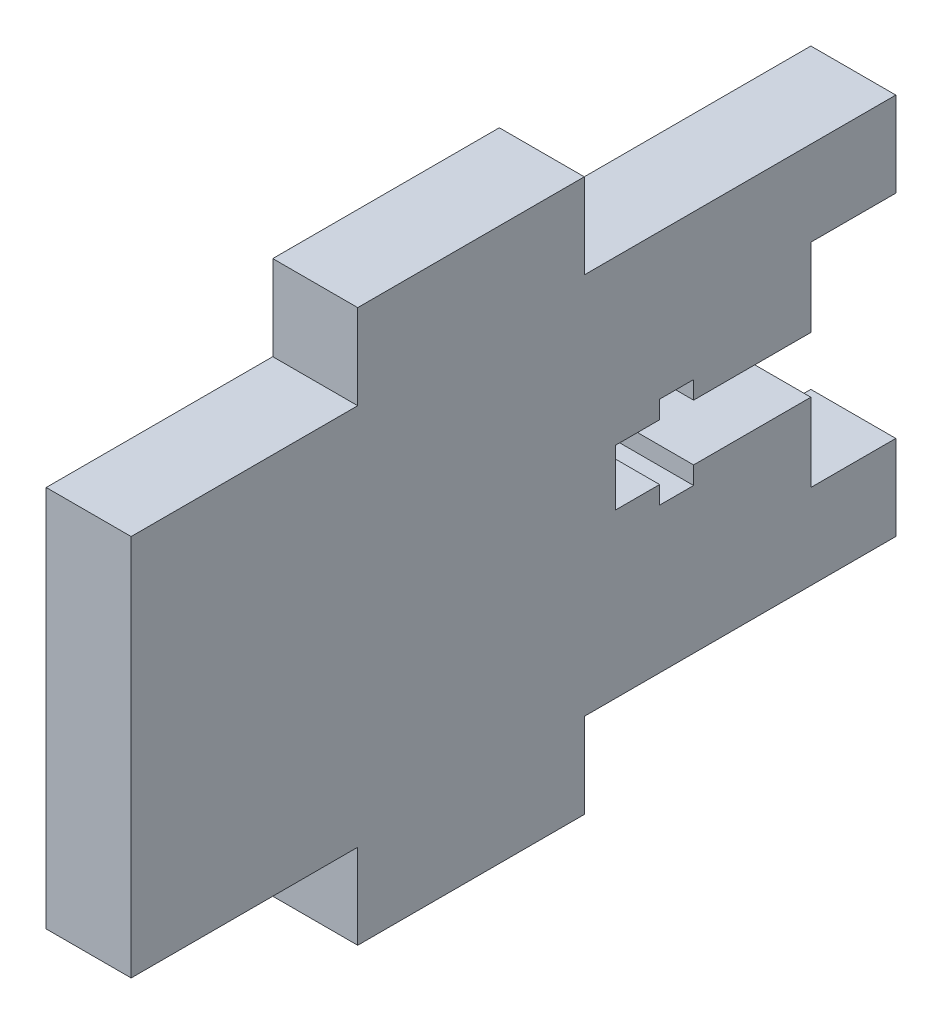
from build123d import *

# Parameters (mm, degrees)
SKETCH1_W           = 6.35
SKETCH1_H           = 28.575
BOSS_EXTRUDE1_DEPTH = 50.8
BOSS_EXTRUDE2_START = -34.925
SKETCH2_W           = 6.35
SKETCH2_H           = 16.933333334
BOSS_EXTRUDE2_DEPTH = 41.275
SKETCH3_W           = 6.35
SKETCH3_H           = 6.35
BOSS_EXTRUDE3_DEPTH = 6.35
CUT_EXTRUDE1_DEPTH  = 56.198450216


with BuildPart() as part:
    # Sketch1 → Boss-Extrude1 (new body)
    with BuildSketch(Plane.XY):
        with Locations((-25.4, 0)):
            Rectangle(SKETCH1_W, SKETCH1_H)
    extrude(amount=BOSS_EXTRUDE1_DEPTH)

    # Sketch2 → Boss-Extrude2 (add)
    with BuildSketch(Plane(origin=(0, -14.2875, 0), x_dir=(-1, 0, 0), z_dir=(0, -1, 0)).offset(BOSS_EXTRUDE2_START)):
        with Locations((25.4, -25.4)):
            Rectangle(SKETCH2_W, SKETCH2_H)
    extrude(amount=BOSS_EXTRUDE2_DEPTH)

    # Sketch3 → Boss-Extrude3 (add)
    with BuildSketch(Plane(origin=(0, 0, 0), x_dir=(-1, 0, 0), z_dir=(0, 0, -1))):
        with Locations((25.4, 11.1125)):
            Rectangle(SKETCH3_W, SKETCH3_H)
        with Locations((25.4, -11.1125)):
            Rectangle(SKETCH3_W, SKETCH3_H)
    extrude(amount=BOSS_EXTRUDE3_DEPTH)

    # Sketch4 → Cut-Extrude1 (cut, through all)
    with BuildSketch(Plane.ZY.offset(28.575)):
        Polygon((0, 2.0955), (0, -2.0955), (8.763, -2.0955), (8.763, -3.429), (11.303, -3.429), (11.303, -2.0955), (14.605, -2.0955), (14.605, 2.0955), (11.303, 2.0955), (11.303, 3.429), (8.763, 3.429), (8.763, 2.0955), align=None)
    extrude(amount=-CUT_EXTRUDE1_DEPTH, mode=Mode.SUBTRACT)


solid = part.part
